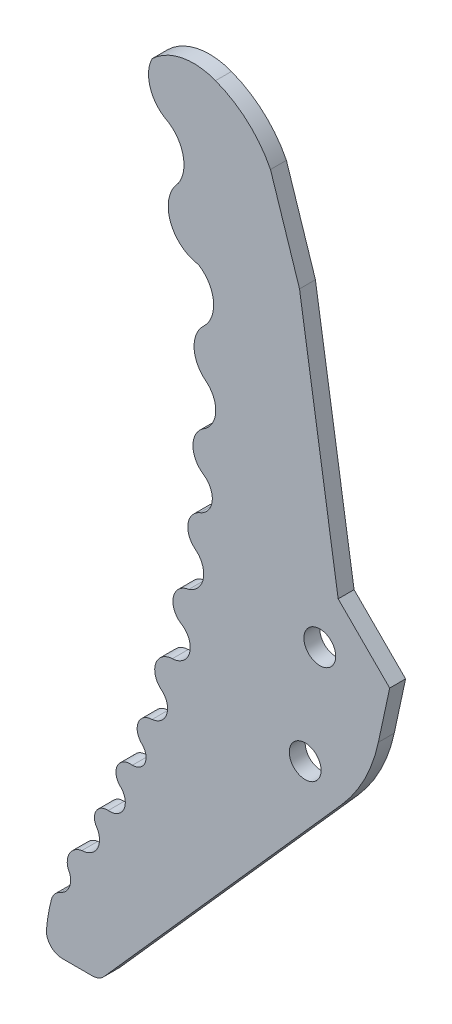
from build123d import *

# Parameters (mm, degrees)
SKETCH1_R               = 1
SKETCH1_R_2             = 2.25
SKETCH1_R_3             = 0.998074624
BOSS_EXTRUDE2_DEPTH     = 1
CUT_EXTRUDE1_DEPTH      = 70.647946454
CUT_EXTRUDE1_DEPTH_BACK = 70.647946454
BOSS_EXTRUDE3_START     = -1
SKETCH3_R               = 0.998074624
BOSS_EXTRUDE3_DEPTH     = 1
BOSS_EXTRUDE4_DEPTH     = 1.1
CUT_EXTRUDE2_DEPTH      = 69.864267842
CUT_EXTRUDE2_DEPTH_BACK = 69.864267842
CUT_EXTRUDE3_DEPTH      = 70.310849907
CUT_EXTRUDE3_DEPTH_BACK = 70.310849907
CUT_EXTRUDE4_DEPTH      = 69.864267842
CUT_EXTRUDE4_DEPTH_BACK = 69.864267842


with BuildPart() as part:
    # Sketch1 → Boss-Extrude2 (new body)
    with BuildSketch(Plane.XY):
        with BuildLine():
            Line((5.146977147, -5.612602955), (7.44171219, -13.199988708))
            ThreePointArc((7.44171219, -13.199988708), (7.439945119, -13.784749424), (7.111476001, -14.268543034))
            ThreePointArc((7.111476001, -14.268543034), (5.923924572, -18.62818009), (9.697794763, -21.113057841))
            ThreePointArc((9.697794763, -21.113057841), (10.380528535, -21.341854349), (10.732574986, -21.969975788))
            ThreePointArc((10.732574986, -21.969975788), (10.791766979, -22.393908793), (10.847713449, -22.818282305))
            ThreePointArc((10.847713449, -22.818282305), (11.790244876, -24.335347863), (11.16321594, -26.007678007))
            ThreePointArc((11.16321594, -26.007678007), (10.570290463, -27.483765064), (11.290805177, -28.901951288))
            ThreePointArc((11.290805177, -28.901951288), (11.931562756, -30.214937196), (11.277042334, -31.52111685))
            ThreePointArc((11.277042334, -31.52111685), (10.500432467, -32.761716535), (11.145287395, -34.075631519))
            ThreePointArc((11.145287395, -34.075631519), (11.711049486, -35.240414102), (10.937199745, -36.278663489))
            ThreePointArc((10.937199745, -36.278663489), (10.185540032, -37.265502357), (10.650830557, -38.415436269))
            ThreePointArc((10.650830557, -38.415436269), (11.153884573, -39.735845823), (10.230304321, -40.805212107))
            ThreePointArc((10.230304321, -40.805212107), (9.263580844, -41.700908083), (9.768401259, -42.918274877))
            ThreePointArc((9.768401259, -42.918274877), (10.29278617, -44.215864041), (9.202326649, -45.093141196))
            ThreePointArc((9.202326649, -45.093141196), (8.144843355, -45.909982105), (8.571180325, -47.176369398))
            ThreePointArc((8.571180325, -47.176369398), (8.845608938, -48.309992252), (7.932024848, -49.035096348))
            ThreePointArc((7.932024848, -49.035096348), (7.054134874, -49.652663659), (7.297145805, -50.698142438))
            ThreePointArc((7.297145805, -50.698142438), (7.486031135, -51.627523472), (6.693279806, -52.148073283))
            ThreePointArc((6.693279806, -52.148073283), (5.736341709, -52.667939714), (5.979078831, -53.729575393))
            ThreePointArc((5.979078831, -53.729575393), (6.146574337, -54.831276595), (5.172832259, -55.373149872))
            ThreePointArc((5.172832259, -55.373149872), (4.397991341, -55.805643097), (4.477975588, -56.689402883))
            ThreePointArc((4.477975588, -56.689402883), (4.477842946, -57.805544451), (3.519463877, -58.377629741))
            ThreePointArc((3.519463877, -58.377629741), (2.763689302, -58.882818754), (2.639049746, -59.78330536))
            ThreePointArc((2.639049746, -59.78330536), (2.762025793, -60.669472955), (2.167842085, -61.338324084))
            ThreePointArc((2.167842085, -61.338324084), (1.808869059, -61.604258533), (1.601521968, -61.999973009))
            ThreePointArc((1.601521968, -61.999973009), (1.407536389, -62.888842845), (1.289722883, -63.790973638))
            ThreePointArc((1.289722883, -63.790973638), (1.548602642, -64.553775113), (2.285909866, -64.878217524))
            Line((2.285909866, -64.878217524), (4.16607409, -64.878217524))
            ThreePointArc((4.16607409, -64.878217524), (4.576078061, -64.790301261), (4.913989999, -64.54201101))
            Line((4.913989999, -64.54201101), (19.858030846, -47.704114694))
            ThreePointArc((19.858030846, -47.704114694), (21.299586827, -45.585122466), (22.155211357, -43.169316519))
            Line((22.155211357, -43.169316519), (25.087470282, -29.538838187))
            ThreePointArc((25.087470282, -29.538838187), (25.281255234, -26.663292069), (24.646889926, -23.851904734))
            Line((24.646889926, -23.851904734), (16.800568019, -3.412304746))
            ThreePointArc((16.800568019, -3.412304746), (16.953922391, -3.093842948), (17.092102067, -2.768509492))
            Line((17.092102067, -2.768509492), (18.529571691, -3.317185246))
            ThreePointArc((18.529571691, -3.317185246), (19.942904756, -2.448680804), (19.102743866, -1.018317214))
            Line((19.102743866, -1.018317214), (17.575945858, -0.827918039))
            ThreePointArc((17.575945858, -0.827918039), (17.62064019, 0.130893048), (17.54251106, 1.087560245))
            Line((17.54251106, 1.087560245), (19.061734148, 1.331127915))
            ThreePointArc((19.061734148, 1.331127915), (19.851464266, 2.789941358), (18.408681797, 3.608592118))
            Line((18.408681797, 3.608592118), (16.991236349, 3.010083636))
            ThreePointArc((16.991236349, 3.010083636), (16.550537232, 3.862785562), (16.004541822, 4.652219092))
            Line((16.004541822, 4.652219092), (17.198443775, 5.622766426))
            ThreePointArc((17.198443775, 5.622766426), (17.152963398, 7.281000986), (15.494151748, 7.268582106))
            Line((15.494151748, 7.268582106), (14.565862222, 6.041535833))
            ThreePointArc((14.565862222, 6.041535833), (13.757854628, 6.559647804), (12.890291968, 6.97031959))
            Line((12.890291968, 6.97031959), (13.438967722, 8.407789214))
            ThreePointArc((13.438967722, 8.407789214), (12.57046328, 9.821122279), (11.140099691, 8.980961389))
            Line((11.140099691, 8.980961389), (10.949700516, 7.454163382))
            ThreePointArc((10.949700516, 7.454163382), (9.990889428, 7.498857714), (9.034222232, 7.420728584))
            Line((9.034222232, 7.420728584), (8.790654561, 8.939951672))
            ThreePointArc((8.790654561, 8.939951672), (7.331841118, 9.729681789), (6.513190359, 8.286899321))
            Line((6.513190359, 8.286899321), (7.11169884, 6.869453872))
            ThreePointArc((7.11169884, 6.869453872), (6.258996915, 6.428754755), (5.469563385, 5.882759346))
            Line((5.469563385, 5.882759346), (4.49901605, 7.076661299))
            ThreePointArc((4.49901605, 7.076661299), (2.840781491, 7.031180921), (2.85320037, 5.372369271))
            Line((2.85320037, 5.372369271), (4.080246644, 4.444079745))
            ThreePointArc((4.080246644, 4.444079745), (3.562134673, 3.636072152), (3.151462886, 2.768509492))
            Line((3.151462886, 2.768509492), (1.713993262, 3.317185246))
            ThreePointArc((1.713993262, 3.317185246), (0.300660197, 2.448680804), (1.140821087, 1.018317214))
            Line((1.140821087, 1.018317214), (2.667619095, 0.827918039))
            ThreePointArc((2.667619095, 0.827918039), (2.622924763, -0.130893048), (2.701053893, -1.087560245))
            Line((2.701053893, -1.087560245), (1.181830804, -1.331127915))
            ThreePointArc((1.181830804, -1.331127915), (0.392100687, -2.789941358), (1.834883156, -3.608592118))
            Line((1.834883156, -3.608592118), (3.252328604, -3.010083636))
            ThreePointArc((3.252328604, -3.010083636), (4.058376197, -4.414193504), (5.146977147, -5.612602955))
        make_face()
        with Locations((10.121782476, 0)):
            Circle(SKETCH1_R, mode=Mode.SUBTRACT)
        with Locations((15.627966379, -9.260281964)):
            Circle(SKETCH1_R_2, mode=Mode.SUBTRACT)
        with Locations((9.121782476, -17.526259213)):
            Circle(SKETCH1_R_3, mode=Mode.SUBTRACT)
        with Locations((22.60685911, -26.49969455)):
            Circle(SKETCH1_R, mode=Mode.SUBTRACT)
        with Locations((22.60685911, -33.166361217)):
            Circle(SKETCH1_R, mode=Mode.SUBTRACT)
        with Locations((18.474150388, -39.833027883)):
            Circle(SKETCH1_R, mode=Mode.SUBTRACT)
        with Locations((17.55481685, -46.49969455)):
            Circle(SKETCH1_R, mode=Mode.SUBTRACT)
        with BuildLine():
            Line((14.500290742, -21.375988683), (12.638736062, -16.487053928))
            ThreePointArc((12.638736062, -16.487053928), (13.337027802, -14.929994394), (14.894087335, -15.628286133))
            Line((14.894087335, -15.628286133), (16.755642015, -20.517220889))
            ThreePointArc((16.755642015, -20.517220889), (16.057350276, -22.074280422), (14.500290742, -21.375988683))
        make_face(mode=Mode.SUBTRACT)
    extrude(amount=BOSS_EXTRUDE2_DEPTH)

    # Sketch2 → Cut-Extrude1 (cut, two sides: drawn at the far end of the back side and taken through both)
    with BuildSketch(Plane.XY.offset(1).offset(-CUT_EXTRUDE1_DEPTH_BACK)):
        Polygon((23.067385557, -38.929114347), (13.377966379, -9.260281964), (6.294344668, -9.406295831), (-11.974505851, 6.419078926), (6.294344668, 12.782954548), (25.940890827, 9.601016737), (30.043126859, -7.362530315), (32.828926707, -29.92513595), align=None)
    extrude(amount=CUT_EXTRUDE1_DEPTH + CUT_EXTRUDE1_DEPTH_BACK, mode=Mode.SUBTRACT)

    # Sketch3 → Boss-Extrude3 (add)
    with BuildSketch(Plane.XY.offset(1).offset(BOSS_EXTRUDE3_START)):
        with Locations((9.121782476, -17.526259213)):
            Circle(SKETCH3_R)
        with BuildLine():
            Line((16.755642015, -20.517220889), (14.894087335, -15.628286133))
            ThreePointArc((14.894087335, -15.628286133), (13.337027802, -14.929994394), (12.638736062, -16.487053928))
            Line((12.638736062, -16.487053928), (14.500290742, -21.375988683))
            ThreePointArc((14.500290742, -21.375988683), (16.057350276, -22.074280422), (16.755642015, -20.517220889))
        make_face()
    extrude(amount=BOSS_EXTRUDE3_DEPTH)

    # Sketch4 → Boss-Extrude4 (add)
    with BuildSketch(Plane.XY.offset(1)):
        with BuildLine():
            Line((10.847713449, -22.818282305), (15.374031166, -15.372197501))
            ThreePointArc((15.374031166, -15.372197501), (13.938899809, -13.492496557), (11.917619823, -12.264773107))
            ThreePointArc((11.917619823, -12.264773107), (9.802354219, -12.078974443), (7.923567461, -13.068433908))
            ThreePointArc((7.923567461, -13.068433908), (7.826972113, -14.745507843), (8.944539239, -15.99968142))
            ThreePointArc((8.944539239, -15.99968142), (9.889006411, -17.376441406), (9.583329231, -19.017796869))
            ThreePointArc((9.583329231, -19.017796869), (9.059868552, -21.302513931), (10.847713449, -22.818282305))
        make_face()
    extrude(amount=-BOSS_EXTRUDE4_DEPTH)

    # Sketch5 → Cut-Extrude2 (cut, two sides: drawn at the far end of the back side and taken through both)
    with BuildSketch(Plane(origin=(0, 0, 0), x_dir=(-1, 0, 0), z_dir=(0, 0, -1)).offset(-CUT_EXTRUDE2_DEPTH_BACK)):
        with BuildLine():
            Line((-7.44171219, -13.199988708), (-6.294344668, -9.406295831))
            Line((-6.294344668, -9.406295831), (-13.377966379, -9.260281964))
            ThreePointArc((-13.377966379, -9.260281964), (-13.489138929, -9.958792624), (-13.811670505, -10.58827643))
            Line((-13.811670505, -10.58827643), (-15.374031166, -15.372197501))
            ThreePointArc((-15.374031166, -15.372197501), (-13.938899809, -13.492496557), (-11.917619823, -12.264773107))
            ThreePointArc((-11.917619823, -12.264773107), (-9.802354219, -12.078974443), (-7.923567461, -13.068433908))
            ThreePointArc((-7.923567461, -13.068433908), (-7.826972113, -14.745507843), (-8.944539239, -15.99968142))
            ThreePointArc((-8.944539239, -15.99968142), (-9.889006411, -17.376441406), (-9.583329231, -19.017796869))
            ThreePointArc((-9.583329231, -19.017796869), (-9.030056336, -19.975340702), (-8.998468155, -21.080783272))
            ThreePointArc((-8.998468155, -21.080783272), (-5.815114314, -18.295104282), (-7.111476001, -14.268543034))
            ThreePointArc((-7.111476001, -14.268543034), (-7.439945119, -13.784749424), (-7.44171219, -13.199988708))
        make_face()
    extrude(amount=CUT_EXTRUDE2_DEPTH + CUT_EXTRUDE2_DEPTH_BACK, mode=Mode.SUBTRACT)

    # Sketch6 → Cut-Extrude3 (cut, two sides: drawn at the far end of the back side and taken through both)
    with BuildSketch(Plane(origin=(9.355814727, 3.05547618, 0), x_dir=(0, 0, -1), z_dir=(0.9505899773939267, 0.31044918244088504, 0)).offset(-CUT_EXTRUDE3_DEPTH_BACK)):
        Polygon((0, -25.058494232), (0.374252859, -25.020494707), (2.926516303, -10.696178036), (0, -13.49636007), align=None)
    extrude(amount=CUT_EXTRUDE3_DEPTH + CUT_EXTRUDE3_DEPTH_BACK, mode=Mode.SUBTRACT)


with BuildPart() as cut_extrude3_piece_1:
    # of the separate pieces the step leaves, piece 1, a body of its own (cut_extrude3_pieces)
    add(part.part.solids().sort_by_distance((4.913989999, -64.54201101, 0))[0])

    # Sketch7 → Cut-Extrude4 (cut, two sides: drawn at the far end of the back side and taken through both)
    with BuildSketch(Plane(origin=(0, 0, 0), x_dir=(-1, 0, 0), z_dir=(0, 0, -1)).offset(-CUT_EXTRUDE4_DEPTH_BACK)):
        Polygon((-22.867386931, -39.858799279), (-19.629269045, -36.620681393), (-17.198561033, -20.958876105), (-20.466436133, -20.958876105), (-26.545979071, -37.447389214), align=None)
    extrude(amount=CUT_EXTRUDE4_DEPTH + CUT_EXTRUDE4_DEPTH_BACK, mode=Mode.SUBTRACT)


with BuildPart() as cut_extrude3_piece_2:
    # of the separate pieces the step leaves, piece 2, a body of its own (cut_extrude3_pieces)
    add(part.part.solids().sort_by_distance((10.855814599, -22.80495539, -0.1))[0])


solid = Compound([cut_extrude3_piece_1.part, cut_extrude3_piece_2.part])
